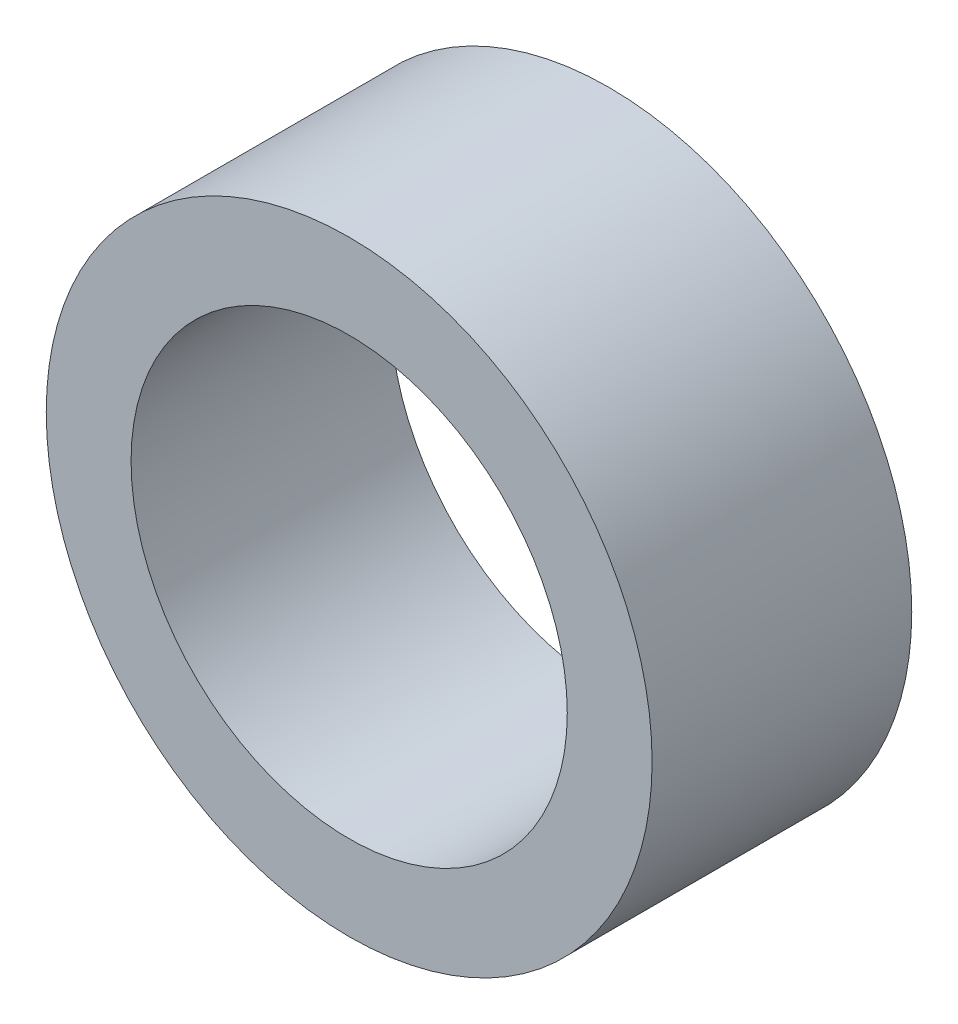
from build123d import *

# Parameters (mm, degrees)
SKETCH_1_R      = 35
SKETCH_1_R_2    = 25.2
EXTRUDE_1_DEPTH = 15


with BuildPart() as part:
    # 草图1 → 凸台-拉伸1 (new, symmetric)
    with BuildSketch(Plane.XY):
        Circle(SKETCH_1_R)
        Circle(SKETCH_1_R_2, mode=Mode.SUBTRACT)
    extrude(amount=EXTRUDE_1_DEPTH, both=True)


solid = part.part
